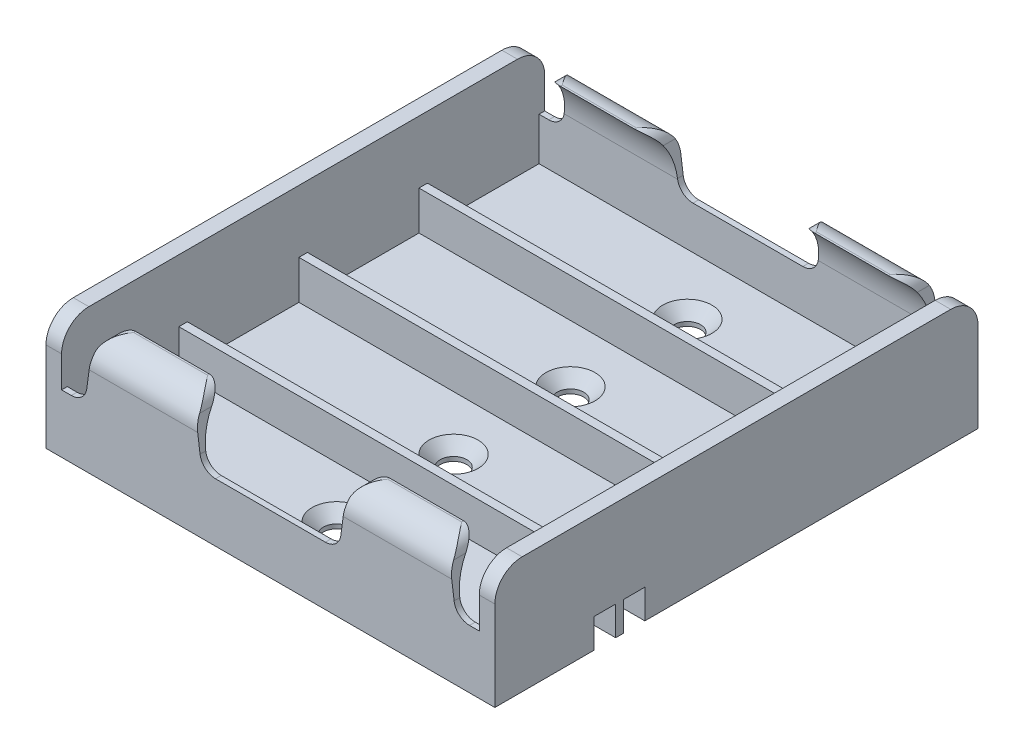
from build123d import *

# Parameters (mm, degrees)
BOSS_EXTRUDE1_DEPTH                             = 28.8
SKETCH2_W                                       = 2.75
SKETCH2_H                                       = 3.75
CUT_EXTRUDE1_DEPTH                              = 3.75
CUT_EXTRUDE2_START                              = -2
CUT_EXTRUDE2_DEPTH                              = 53.6
SKETCH4_W                                       = 53.6
SKETCH4_H                                       = 54.504926328
CUT_EXTRUDE3_DEPTH                              = 8
CSK_FOR_M3_FLAT_HEAD_MACHINE_SCREW1_D           = 3.4
CSK_FOR_M3_FLAT_HEAD_MACHINE_SCREW1_DEPTH       = 7.874
CSK_FOR_M3_FLAT_HEAD_MACHINE_SCREW1_CSINK_D     = 6.3
CSK_FOR_M3_FLAT_HEAD_MACHINE_SCREW1_CSINK_ANGLE = 90
CSK_FOR_M3_FLAT_HEAD_MACHINE_SCREW1_TIP         = 1.021463052
CUT_EXTRUDE4_DEPTH                              = 45.893652113


with BuildPart() as part:
    # Sketch1 → Boss-Extrude1 (new, symmetric)
    with BuildSketch(Plane(origin=(0, 0, 0), x_dir=(0, 0, -1), z_dir=(1, 0, 0))):
        with BuildLine():
            Line((0, 0), (31, 0))
            Line((31, 0), (31, 11.5))
            ThreePointArc((31, 11.5), (29.974873734, 13.974873734), (27.5, 15))
            Line((27.5, 15), (0, 15))
            Line((0, 15), (0, 0))
        make_face()
    boss_extrude1 = extrude(amount=BOSS_EXTRUDE1_DEPTH, both=True)

    # Mirror1: Boss-Extrude1 across plane
    add(boss_extrude1.mirror(Plane(origin=(28.8, 15, 0), x_dir=(1, 0, 0), z_dir=(0, 0, -1))))

    # Sketch2 → Cut-Extrude1 (cut)
    with BuildSketch(Plane(origin=(28.8, 0, 0), x_dir=(0, 0, -1), z_dir=(1, 0, 0))):
        with Locations((-16.8750001, 1.875)):
            Rectangle(SKETCH2_W, SKETCH2_H)
        with Locations((-13.1250001, 1.875)):
            Rectangle(SKETCH2_W, SKETCH2_H)
    extrude(amount=-CUT_EXTRUDE1_DEPTH, mode=Mode.SUBTRACT)

    # Sketch3 → Cut-Extrude2 (cut)
    with BuildSketch(Plane(origin=(28.8, 0, 0), x_dir=(0, 0, -1), z_dir=(1, 0, 0)).offset(CUT_EXTRUDE2_START)):
        with BuildLine():
            Line((-30.270000062, 9.160000031), (-30.270000062, 2))
            Line((-30.270000062, 2), (-15.95, 2))
            Line((-15.95, 2), (-15.95, 9.160000031))
            ThreePointArc((-15.95, 9.160000031), (-23.110000031, 16.320000062), (-30.270000062, 9.160000031))
        make_face()
        with BuildLine():
            Line((-14.863333375, 9.160000031), (-14.863333375, 2))
            Line((-14.863333375, 2), (-0.543333313, 2))
            Line((-0.543333313, 2), (-0.543333313, 9.160000031))
            ThreePointArc((-0.543333313, 9.160000031), (-7.703333344, 16.320000062), (-14.863333375, 9.160000031))
        make_face()
    cut_extrude2 = extrude(amount=-CUT_EXTRUDE2_DEPTH, mode=Mode.SUBTRACT)

    # Mirror2: Cut-Extrude2 across plane
    add(cut_extrude2.mirror(Plane.XY), mode=Mode.SUBTRACT)

    # Sketch4 → Cut-Extrude3 (cut)
    with BuildSketch(Plane(origin=(0, 15, 0), x_dir=(1, 0, 0), z_dir=(0, 1, 0))):
        Rectangle(SKETCH4_W, SKETCH4_H)
    extrude(amount=-CUT_EXTRUDE3_DEPTH, mode=Mode.SUBTRACT)

    # CSK for M3 Flat Head Machine Screw1
    with Locations(Plane(origin=(0, 2, -22.5), x_dir=(0, 0, 1), z_dir=(0, 1, 0))):
        with Locations((0, 0), (15, 0), (30, 0), (45, 0)):
            CounterSinkHole(CSK_FOR_M3_FLAT_HEAD_MACHINE_SCREW1_D / 2, CSK_FOR_M3_FLAT_HEAD_MACHINE_SCREW1_CSINK_D / 2, depth=CSK_FOR_M3_FLAT_HEAD_MACHINE_SCREW1_DEPTH, counter_sink_angle=CSK_FOR_M3_FLAT_HEAD_MACHINE_SCREW1_CSINK_ANGLE)
            with Locations((0, 0, -(CSK_FOR_M3_FLAT_HEAD_MACHINE_SCREW1_DEPTH + CSK_FOR_M3_FLAT_HEAD_MACHINE_SCREW1_TIP / 2))):  # 118° drill point
                Cone(0, CSK_FOR_M3_FLAT_HEAD_MACHINE_SCREW1_D / 2, CSK_FOR_M3_FLAT_HEAD_MACHINE_SCREW1_TIP, mode=Mode.SUBTRACT)

    # Sketch7 → Cut-Extrude4 (cut, symmetric)
    with BuildSketch(Plane.XY):
        with BuildLine():
            Line((-26.8, 15), (-26.8, 7.5))
            Line((-26.8, 7.5), (-25.551032793, 7.5))
            ThreePointArc((-25.551032793, 7.5), (-24.233583531, 7.995231765), (-23.568576992, 9.23567256))
            Line((-23.568576992, 9.23567256), (-23.031423008, 13.26432744))
            ThreePointArc((-23.031423008, 13.26432744), (-22.366416469, 14.504768235), (-21.048967207, 15))
            Line((-21.048967207, 15), (-22.8, 15))
            Line((-22.8, 15), (-26.8, 15))
        make_face()
        with BuildLine():
            Line((-9.568576992, 13.26432744), (-9.031423008, 9.23567256))
            ThreePointArc((-9.031423008, 9.23567256), (-8.366416469, 7.995231765), (-7.048967207, 7.5))
            Line((-7.048967207, 7.5), (0, 7.5))
            Line((0, 7.5), (0, 15))
            Line((0, 15), (-9.8, 15))
            Line((-9.8, 15), (-11.551032793, 15))
            ThreePointArc((-11.551032793, 15), (-10.233583531, 14.504768235), (-9.568576992, 13.26432744))
        make_face()
    cut_extrude4 = extrude(amount=CUT_EXTRUDE4_DEPTH, both=True, mode=Mode.SUBTRACT)

    # Mirror3: Cut-Extrude4 across plane
    add(cut_extrude4.mirror(Plane(origin=(0, 0, 0), x_dir=(0, 0, 1), z_dir=(1, 0, 0))), mode=Mode.SUBTRACT)


solid = part.part
